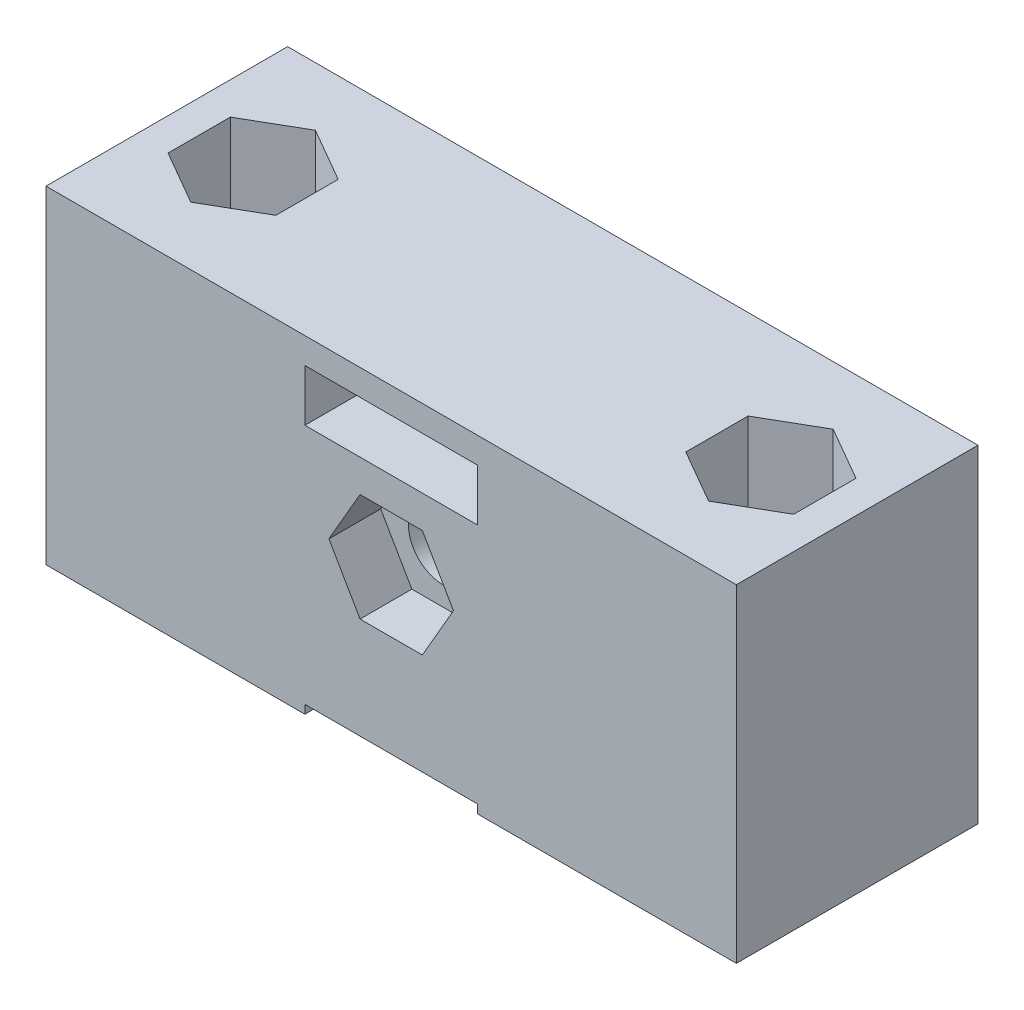
from build123d import *

# Parameters (mm, degrees)
SKETCH1_W           = 40
SKETCH1_H           = 14
BOSS_EXTRUDE1_DEPTH = 19
SKETCH2_W           = 10
SKETCH2_H           = 3
SKETCH2_H_2         = 1
CUT_EXTRUDE1_DEPTH  = 30
SKETCH3_R           = 2
CUT_EXTRUDE2_DEPTH  = 31.935416597
SKETCH4_R           = 1.6
CUT_EXTRUDE3_DEPTH  = 29.460498942
CUT_EXTRUDE4_DEPTH  = 10
CUT_EXTRUDE5_DEPTH  = 3


with BuildPart() as part:
    # Sketch1 → Boss-Extrude1 (new body)
    with BuildSketch(Plane(origin=(0, 0, 0), x_dir=(1, 0, 0), z_dir=(0, 1, 0))):
        Rectangle(SKETCH1_W, SKETCH1_H)
    extrude(amount=BOSS_EXTRUDE1_DEPTH)

    # Sketch2 → Cut-Extrude1 (cut)
    with BuildSketch(Plane.XY.offset(7)):
        with Locations((0, 16)):
            Rectangle(SKETCH2_W, SKETCH2_H)
        Rectangle(SKETCH2_W, SKETCH2_H_2)
    extrude(amount=-CUT_EXTRUDE1_DEPTH, mode=Mode.SUBTRACT)

    # Sketch3 → Cut-Extrude2 (cut, through all)
    with BuildSketch(Plane.XY.offset(7)):
        with Locations((0, 9.5)):
            Circle(SKETCH3_R)
    extrude(amount=-CUT_EXTRUDE2_DEPTH, mode=Mode.SUBTRACT)

    # Sketch4 → Cut-Extrude3 (cut, through all)
    with BuildSketch(Plane(origin=(0, 19, 0), x_dir=(1, 0, 0), z_dir=(0, 1, 0))):
        with Locations(Location((-15, 0, 0), (0, 0, 270))):
            Circle(SKETCH4_R)
        with Locations(Location((15, 0, 0), (0, 0, 90))):
            Circle(SKETCH4_R)
    extrude(amount=-CUT_EXTRUDE3_DEPTH, mode=Mode.SUBTRACT)

    # Sketch9 → Cut-Extrude4 (cut)
    with BuildSketch(Plane(origin=(0, 19, 0), x_dir=(1, 0, 0), z_dir=(0, 1, 0))):
        Polygon((-15, 3.608439182), (-18.125, 1.804219591), (-18.125, -1.804219591), (-15, -3.608439182), (-11.875, -1.804219591), (-11.875, 1.804219591), align=None)
        Polygon((11.875, 1.804219591), (15, 3.608439182), (18.125, 1.804219591), (18.125, -1.804219591), (15, -3.608439182), (11.875, -1.804219591), align=None)
    extrude(amount=-CUT_EXTRUDE4_DEPTH, mode=Mode.SUBTRACT)

    # Sketch10 → Cut-Extrude5 (cut)
    with BuildSketch(Plane.XY.offset(7)):
        Polygon((1.804219591, 12.625), (-1.804219591, 12.625), (-3.608439182, 9.5), (-1.804219591, 6.375), (1.804219591, 6.375), (3.608439182, 9.5), align=None)
    extrude(amount=-CUT_EXTRUDE5_DEPTH, mode=Mode.SUBTRACT)


solid = part.part
